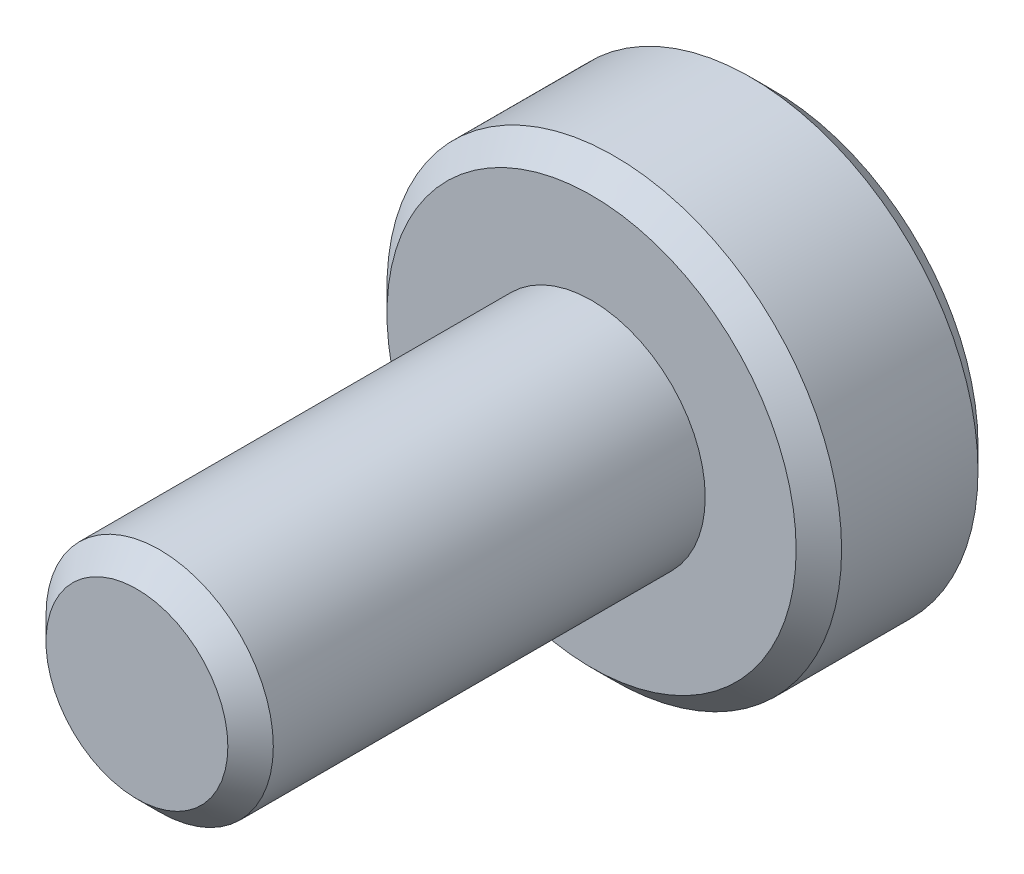
from build123d import *

# Parameters (mm, degrees)
CROQUIS1_R              = 10
SALIENTE_EXTRUIR1_DEPTH = 8
CROQUIS2_R              = 5
SALIENTE_EXTRUIR2_DEPTH = 20
CHAFL_N1_SIZE           = 1
CHAFL_N2_SIZE           = 1


with BuildPart() as part:
    # Croquis1 → Saliente-Extruir1 (new body)
    with BuildSketch(Plane.XY):
        Circle(CROQUIS1_R)
    extrude(amount=SALIENTE_EXTRUIR1_DEPTH)

    # Croquis2 → Saliente-Extruir2 (add)
    with BuildSketch(Plane.XY.offset(8)):
        Circle(CROQUIS2_R)
    extrude(amount=SALIENTE_EXTRUIR2_DEPTH)

    # Chaflán1
    chafl_n1_edges = [part.edges().sort_by_distance(p)[0] for p in [
        (-10, 0, 0),
        (-10, 0, 8),
    ]]
    chamfer(chafl_n1_edges, length=CHAFL_N1_SIZE)

    # Chaflán2
    chafl_n2_edges = [part.edges().sort_by_distance(p)[0] for p in [
        (-5, 0, 28),
    ]]
    chamfer(chafl_n2_edges, length=CHAFL_N2_SIZE)


solid = part.part
